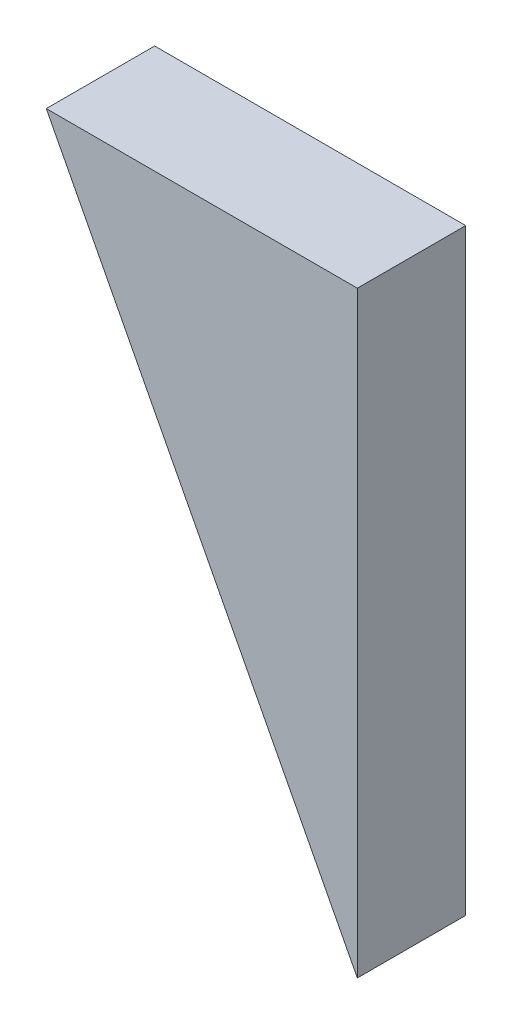
from build123d import *

# Parameters (mm, degrees)
BOSS_EXTRUDE1_DEPTH = 6.35


with BuildPart() as part:
    # Sketch1 → Boss-Extrude1 (new body)
    with BuildSketch(Plane.XY):
        Polygon((0, -15), (0, 20), (-18.225, 20), align=None)
    extrude(amount=-BOSS_EXTRUDE1_DEPTH)


solid = part.part
